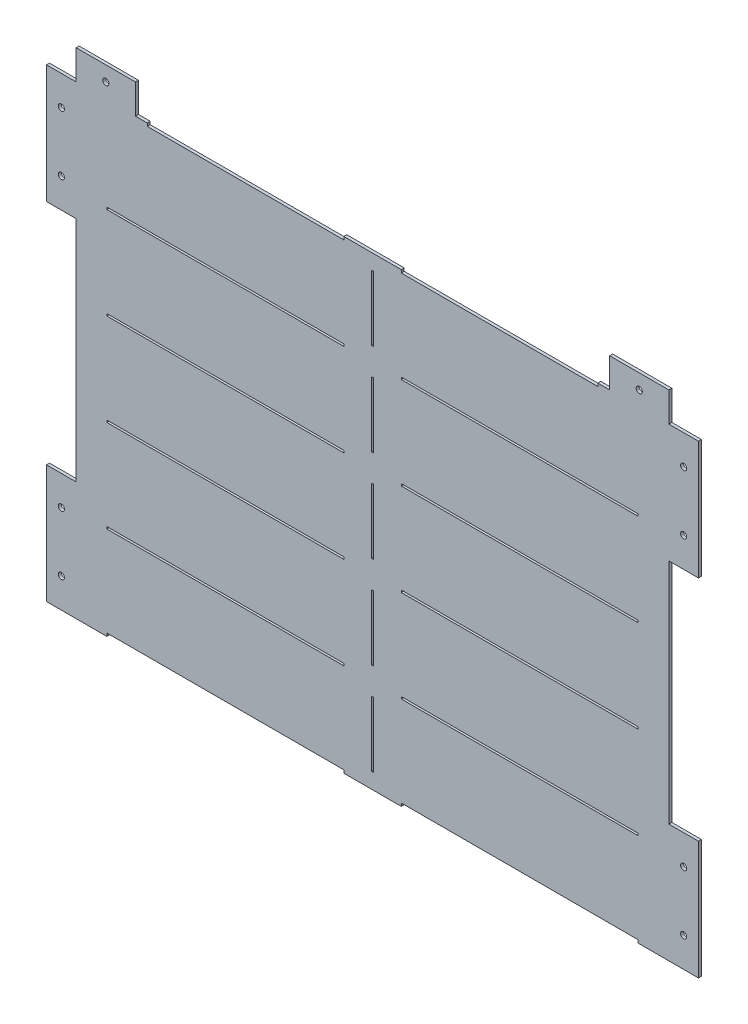
from build123d import *

# Parameters (mm, degrees)
MASTER_SKETCH_W         = 635.3556
MASTER_SKETCH_H         = 498.348
BOSS_EXTRUDE1_DEPTH     = 3.175
SKETCH2_W               = 31.75
SKETCH2_H               = 127
BOSS_EXTRUDE2_DEPTH     = 3.175
M6_CLEARANCE_HOLE1_D    = 6.6
MIRROR7_COPY_1_SKETCH_W = 31.75
MIRROR7_COPY_1_SKETCH_H = 127
MIRROR7_COPY_1_DEPTH    = 3.175
MIRROR7_COPY_2_D        = 6.6
SKETCH5_W               = 2.286
SKETCH5_H               = 69.85
CUT_EXTRUDE1_DEPTH      = 430.182420788
LPATTERN1_COUNT         = 5
LPATTERN1_PITCH         = 98.8568
SKETCH7_W               = 254
SKETCH7_H               = 2.286
CUT_EXTRUDE3_DEPTH      = 430.182420788
LPATTERN2_COUNT         = 4
LPATTERN2_PITCH         = 98.8568
MIRROR4_COPY_1_SKETCH_W = 254
MIRROR4_COPY_1_SKETCH_H = 2.286
MIRROR4_COPY_1_DEPTH    = 430.182420788
MIRROR4_COPY_2_SKETCH_W = 254
MIRROR4_COPY_2_SKETCH_H = 2.286
MIRROR4_COPY_2_DEPTH    = 430.182420788
MIRROR4_COPY_3_SKETCH_W = 254
MIRROR4_COPY_3_SKETCH_H = 2.286
MIRROR4_COPY_3_DEPTH    = 430.182420788
SKETCH10_W              = 63.5
SKETCH10_H              = 31.75
SKETCH10_R              = 3
BOSS_EXTRUDE3_DEPTH     = 3.175
M6_CLEARANCE_HOLE2_D    = 6.6
SKETCH6_W               = 254
SKETCH6_H               = 3.175
SKETCH6_W_2             = 210.6549
CUT_EXTRUDE2_DEPTH      = 449.361641774


with BuildPart() as part:
    # Master Sketch → Boss-Extrude1 (new body)
    with BuildSketch(Plane.XY):
        Rectangle(MASTER_SKETCH_W, MASTER_SKETCH_H)
    extrude(amount=BOSS_EXTRUDE1_DEPTH)

    # Sketch2 → Boss-Extrude2 (add)
    with BuildSketch(Plane.XY.offset(3.175)):
        with Locations((-333.5528, -185.674)):
            Rectangle(SKETCH2_W, SKETCH2_H)
    boss_extrude2 = extrude(amount=-BOSS_EXTRUDE2_DEPTH)

    # M6 Clearance Hole1 (through all)
    with Locations(Plane.XY.offset(3.175)):
        with Locations((-333.5528, -217.424), (-333.5528, -153.924)):
            m6_clearance_hole1 = Hole(M6_CLEARANCE_HOLE1_D / 2)

    # Mirror1: Boss-Extrude2, M6 Clearance Hole1 across plane
    add(boss_extrude2.mirror(Plane(origin=(0, 0, 0), x_dir=(0, 0, 1), z_dir=(1, 0, 0))))
    add(m6_clearance_hole1.mirror(Plane(origin=(0, 0, 0), x_dir=(0, 0, 1), z_dir=(1, 0, 0))), mode=Mode.SUBTRACT)

    # Mirror7: Boss-Extrude2, M6 Clearance Hole1 across plane
    add(boss_extrude2.mirror(Plane.ZX))
    add(m6_clearance_hole1.mirror(Plane.ZX), mode=Mode.SUBTRACT)

    # Mirror7 copy 1 sketch → Mirror7 copy 1 (add)
    with BuildSketch(Plane(origin=(0, 0, 3.175), x_dir=(-1, 0, 0), z_dir=(0, 0, 1))):
        with Locations((-333.5528, -185.674)):
            Rectangle(MIRROR7_COPY_1_SKETCH_W, MIRROR7_COPY_1_SKETCH_H)
    extrude(amount=-MIRROR7_COPY_1_DEPTH)

    # Mirror7 copy 2 (through all)
    with Locations(Plane(origin=(0, 0, 3.175), x_dir=(-1, 0, 0), z_dir=(0, 0, 1))):
        with Locations((-333.5528, -217.424), (-333.5528, -153.924)):
            Hole(MIRROR7_COPY_2_D / 2)

    # Sketch5 → Cut-Extrude1 (cut, through all)
    with BuildSketch(Plane.XY.offset(3.175)):
        with Locations((0, 197.7136)):
            Rectangle(SKETCH5_W, SKETCH5_H)
    cut_extrude1 = extrude(amount=-CUT_EXTRUDE1_DEPTH, mode=Mode.SUBTRACT)

    # LPattern1: Cut-Extrude1 ×5
    with Locations(*[(0, -i * LPATTERN1_PITCH, 0) for i in range(1, LPATTERN1_COUNT)]):
        add(cut_extrude1, mode=Mode.SUBTRACT)

    # Sketch7 → Cut-Extrude3 (cut, through all)
    with BuildSketch(Plane.XY.offset(3.175)):
        with Locations((-157.8229, 148.2852)):
            Rectangle(SKETCH7_W, SKETCH7_H)
    cut_extrude3 = extrude(amount=-CUT_EXTRUDE3_DEPTH, mode=Mode.SUBTRACT)

    # LPattern2: Cut-Extrude3 ×4
    with Locations(*[(0, -i * LPATTERN2_PITCH, 0) for i in range(1, LPATTERN2_COUNT)]):
        add(cut_extrude3, mode=Mode.SUBTRACT)

    # Mirror4: Cut-Extrude3 across plane
    add(cut_extrude3.mirror(Plane(origin=(0, 0, 0), x_dir=(0, 0, 1), z_dir=(1, 0, 0))), mode=Mode.SUBTRACT)

    # Mirror4 copy 1 sketch → Mirror4 copy 1 (cut, through all)
    with BuildSketch(Plane(origin=(0, -98.8568, 3.175), x_dir=(-1, 0, 0), z_dir=(0, 0, 1))):
        with Locations((-157.8229, -148.2852)):
            Rectangle(MIRROR4_COPY_1_SKETCH_W, MIRROR4_COPY_1_SKETCH_H)
    extrude(amount=-MIRROR4_COPY_1_DEPTH, mode=Mode.SUBTRACT)

    # Mirror4 copy 2 sketch → Mirror4 copy 2 (cut, through all)
    with BuildSketch(Plane(origin=(0, -197.7136, 3.175), x_dir=(-1, 0, 0), z_dir=(0, 0, 1))):
        with Locations((-157.8229, -148.2852)):
            Rectangle(MIRROR4_COPY_2_SKETCH_W, MIRROR4_COPY_2_SKETCH_H)
    extrude(amount=-MIRROR4_COPY_2_DEPTH, mode=Mode.SUBTRACT)

    # Mirror4 copy 3 sketch → Mirror4 copy 3 (cut, through all)
    with BuildSketch(Plane(origin=(0, -296.5704, 3.175), x_dir=(-1, 0, 0), z_dir=(0, 0, 1))):
        with Locations((-157.8229, -148.2852)):
            Rectangle(MIRROR4_COPY_3_SKETCH_W, MIRROR4_COPY_3_SKETCH_H)
    extrude(amount=-MIRROR4_COPY_3_DEPTH, mode=Mode.SUBTRACT)

    # Sketch10 → Boss-Extrude3 (add)
    with BuildSketch(Plane.XY.offset(3.175)):
        with Locations((-285.9278, 265.049)):
            Rectangle(SKETCH10_W, SKETCH10_H)
        with Locations((-285.9278, 265.049)):
            Circle(SKETCH10_R, mode=Mode.SUBTRACT)
    boss_extrude3 = extrude(amount=-BOSS_EXTRUDE3_DEPTH)

    # M6 Clearance Hole2 (through all)
    with Locations(Plane.XY.offset(3.175)):
        with Locations((-285.9278, 265.049)):
            m6_clearance_hole2 = Hole(M6_CLEARANCE_HOLE2_D / 2)

    # Mirror6: Boss-Extrude3, M6 Clearance Hole2 across plane
    add(boss_extrude3.mirror(Plane(origin=(0, 0, 0), x_dir=(0, 0, 1), z_dir=(1, 0, 0))))
    add(m6_clearance_hole2.mirror(Plane(origin=(0, 0, 0), x_dir=(0, 0, 1), z_dir=(1, 0, 0))), mode=Mode.SUBTRACT)

    # Sketch6 → Cut-Extrude2 (cut, through all)
    with BuildSketch(Plane.XY.offset(3.175)):
        with Locations((-157.8229, -247.5865)):
            Rectangle(SKETCH6_W, SKETCH6_H)
        with Locations((157.8229, -247.5865)):
            Rectangle(SKETCH6_W, SKETCH6_H)
        with Locations((-136.15035, 247.5865)):
            Rectangle(SKETCH6_W_2, SKETCH6_H)
        with Locations((136.15035, 247.5865)):
            Rectangle(SKETCH6_W_2, SKETCH6_H)
    extrude(amount=-CUT_EXTRUDE2_DEPTH, mode=Mode.SUBTRACT)


solid = part.part
